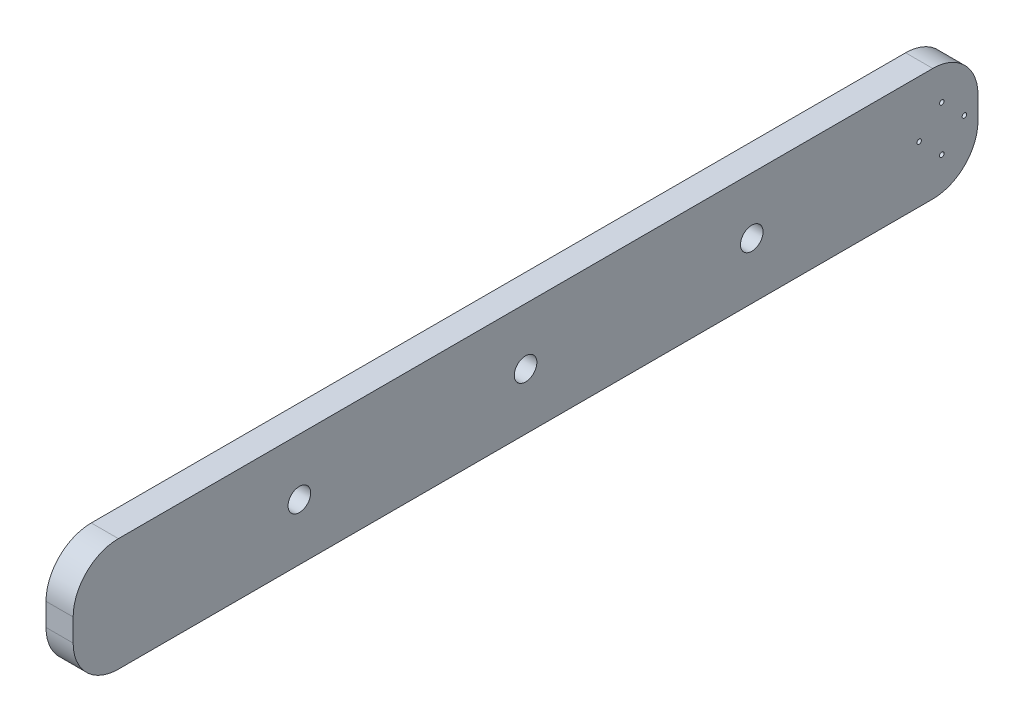
from build123d import *

# Parameters (mm, degrees)
BOSS_EXTRU_1_DEPTH      = 6
ESQUISSE2_R             = 0.5
ESQUISSE2_R_2           = 2.5
ENL_V_MAT_EXTRU_1_DEPTH = 6


with BuildPart() as part:
    # Esquisse1 → Boss.-Extru.1 (new body)
    with BuildSketch(Plane(origin=(0, 0, 0), x_dir=(0, 0, -1), z_dir=(1, 0, 0))):
        with BuildLine():
            Line((90, -12.5), (-90, -12.5))
            ThreePointArc((-90, -12.5), (-97.071067812, -9.571067812), (-100, -2.5))
            Line((-100, -2.5), (-100, 2.5))
            ThreePointArc((-100, 2.5), (-97.071067812, 9.571067812), (-90, 12.5))
            Line((-90, 12.5), (90, 12.5))
            ThreePointArc((90, 12.5), (97.071067812, 9.571067812), (100, 2.5))
            Line((100, 2.5), (100, -2.5))
            ThreePointArc((100, -2.5), (97.071067812, -9.571067812), (90, -12.5))
        make_face()
    extrude(amount=BOSS_EXTRU_1_DEPTH)

    # Esquisse2 → Enlèv. mat.-Extru.1 (cut)
    with BuildSketch(Plane.ZY):
        with Locations((-97, 0)):
            Circle(ESQUISSE2_R)
        with Locations((-92, 5)):
            Circle(ESQUISSE2_R)
        with Locations(Location((-92, -5, 0), (0, 0, 180))):
            Circle(ESQUISSE2_R)
        with Locations(Location((-87, 0, 0), (0, 0, 180))):
            Circle(ESQUISSE2_R)
        with Locations((-50, 0)):
            Circle(ESQUISSE2_R_2)
        Circle(ESQUISSE2_R_2)
        with Locations((50, 0)):
            Circle(ESQUISSE2_R_2)
    extrude(amount=-ENL_V_MAT_EXTRU_1_DEPTH, mode=Mode.SUBTRACT)


solid = part.part
